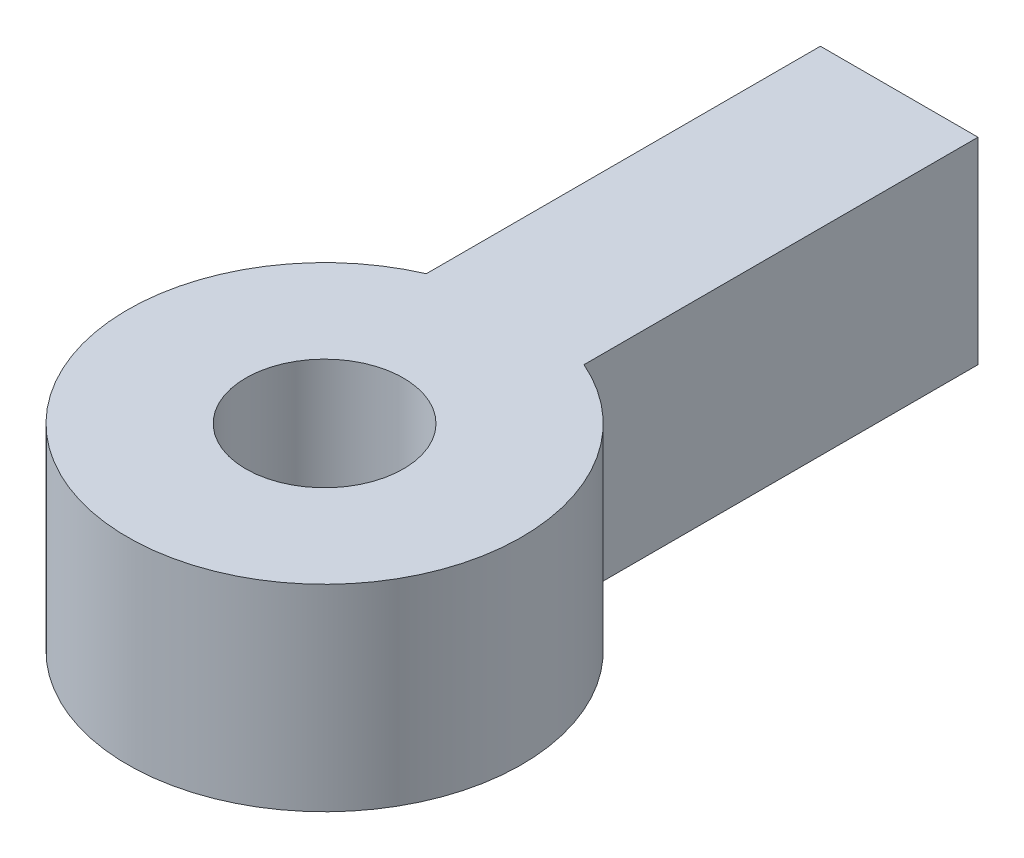
from build123d import *

# Parameters (mm, degrees)
SKETCH1_R           = 2
BOSS_EXTRUDE1_DEPTH = 5


with BuildPart() as part:
    # Sketch1 → Boss-Extrude1 (new body)
    with BuildSketch(Plane(origin=(0, 0, 0), x_dir=(1, 0, 0), z_dir=(0, 1, 0))):
        with BuildLine():
            Line((-2, 14.582575695), (2, 14.582575695))
            Line((2, 14.582575695), (2, 4.582575695))
            ThreePointArc((2, 4.582575695), (0, -5), (-2, 4.582575695))
            Line((-2, 4.582575695), (-2, 14.582575695))
        make_face()
        with Locations(Location((0, 0, 0), (0, 0, 270))):
            Circle(SKETCH1_R, mode=Mode.SUBTRACT)
    extrude(amount=BOSS_EXTRUDE1_DEPTH)


solid = part.part
